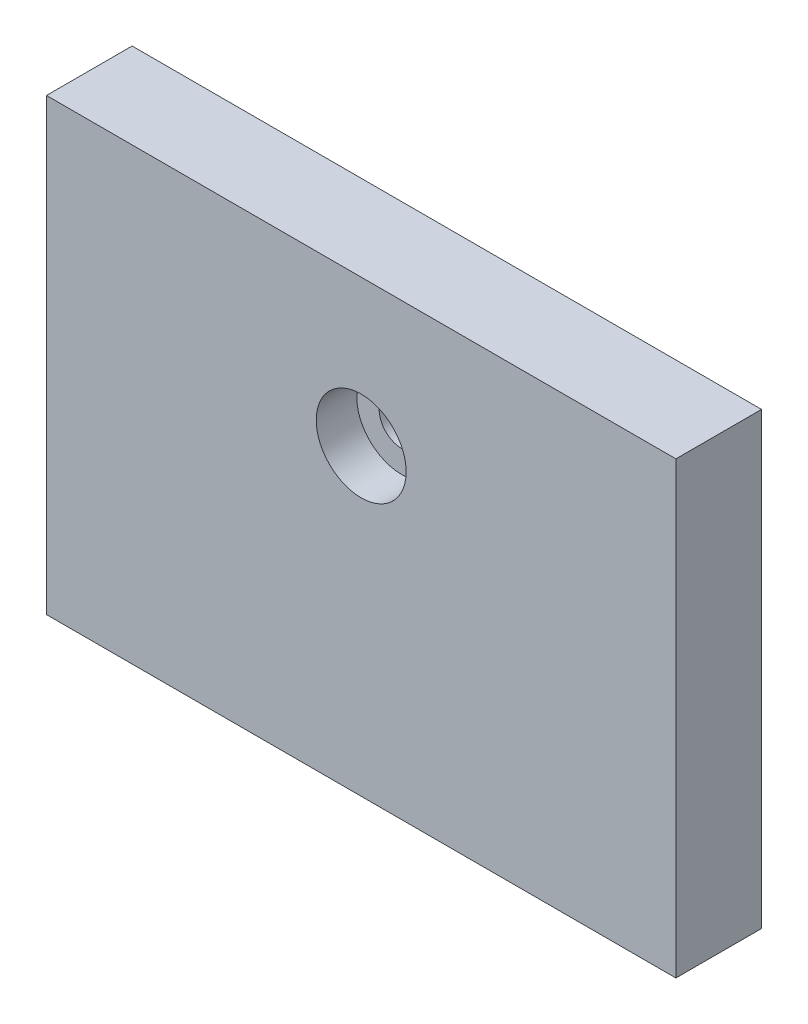
from build123d import *

# Parameters (mm, degrees)
CROQUIS1_W              = 70
CROQUIS1_H              = 50
CROQUIS1_R              = 2.5
SALIENTE_EXTRUIR1_DEPTH = 9.525
CROQUIS2_R              = 5
CORTAR_EXTRUIR1_DEPTH   = 4.5


with BuildPart() as part:
    # Croquis1 → Saliente-Extruir1 (new body)
    with BuildSketch(Plane.XY):
        Rectangle(CROQUIS1_W, CROQUIS1_H)
        with Locations(Location((0, 8.742399315, 0), (0, 0, 180))):
            Circle(CROQUIS1_R, mode=Mode.SUBTRACT)
    extrude(amount=SALIENTE_EXTRUIR1_DEPTH)

    # Croquis2 → Cortar-Extruir1 (cut)
    with BuildSketch(Plane.XY.offset(9.525)):
        with Locations((0, 8.742399315)):
            Circle(CROQUIS2_R)
    extrude(amount=-CORTAR_EXTRUIR1_DEPTH, mode=Mode.SUBTRACT)


solid = part.part
